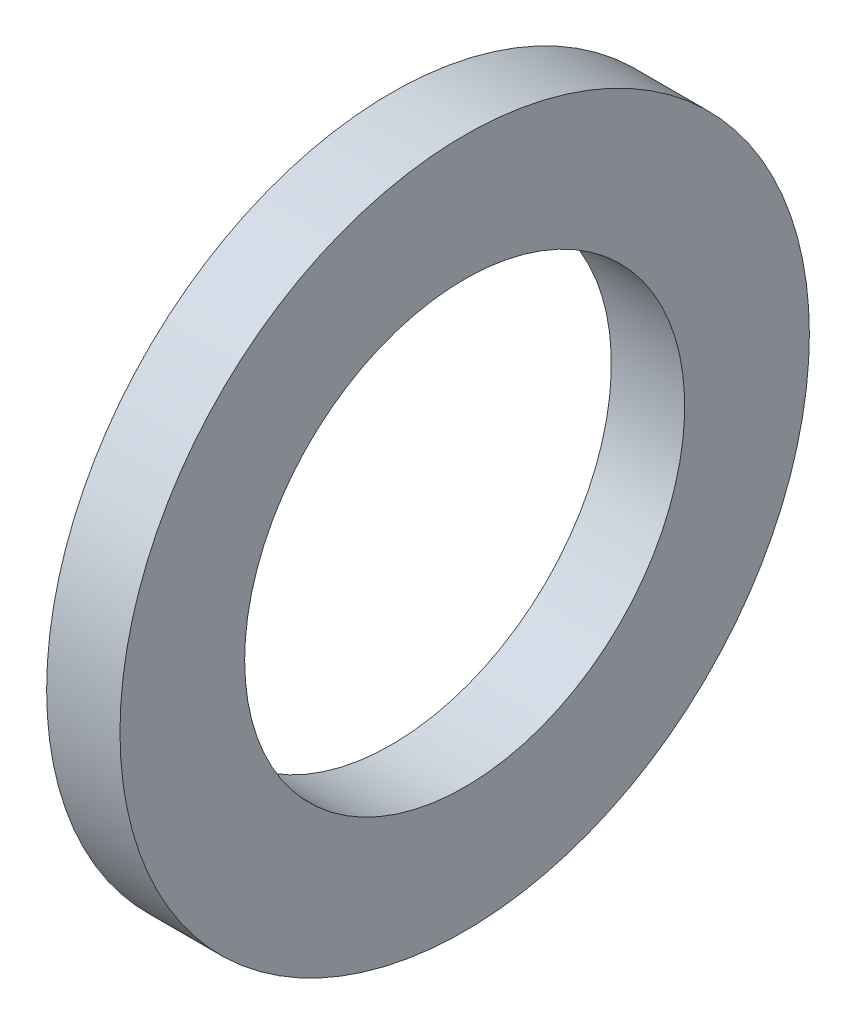
from build123d import *

# Parameters (mm, degrees)
SZKIC1_W = 5
SZKIC1_H = 8.5


with BuildPart() as part:
    # Szkic1 → Obrót1 (revolve)
    with BuildSketch(Plane.XY, mode=Mode.PRIVATE) as obr_t1_sk:
        with Locations((-9.038709048, -181.492259127)):
            Rectangle(SZKIC1_W, SZKIC1_H)
    revolve(obr_t1_sk.sketch.rotate(Axis((-51.4495482, -200.742259127, 0), (1, 0, 0)), 90), axis=Axis((-51.4495482, -200.742259127, 0), (1, 0, 0)))


solid = part.part
